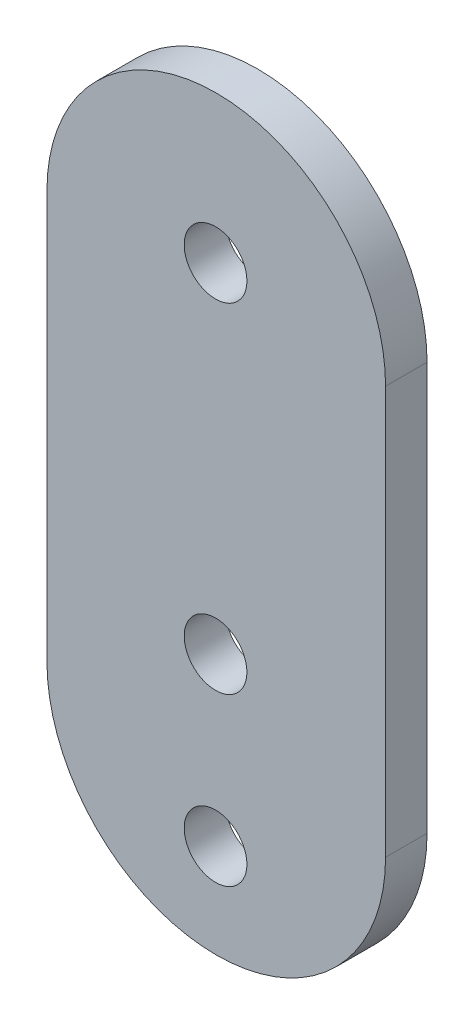
from build123d import *

# Parameters (mm, degrees)
BOSS_EXTRUDE1_DEPTH = 2.778125
SKETCH3_R           = 2.1
CUT_EXTRUDE1_DEPTH  = 10


with BuildPart() as part:
    # Sketch1 → Boss-Extrude1 (new body)
    with BuildSketch(Plane.XY):
        with BuildLine():
            Line((-29.866346965, 39.245435109), (-29.866346965, 11.924084761))
            ThreePointArc((-29.866346965, 11.924084761), (-18.527022139, 0.584759935), (-7.187697313, 11.924084761))
            Line((-7.187697313, 11.924084761), (-7.187697313, 39.245435109))
            ThreePointArc((-7.187697313, 39.245435109), (-18.527022139, 50.584759935), (-29.866346965, 39.245435109))
        make_face()
    extrude(amount=BOSS_EXTRUDE1_DEPTH)

    # Sketch3 → Cut-Extrude1 (cut)
    with BuildSketch(Plane.XY.offset(2.778125)):
        with Locations((-18.573973328, 6.87125142)):
            Circle(SKETCH3_R)
        with Locations((-18.573973328, 18.010449169)):
            Circle(SKETCH3_R)
        with Locations((-18.573973328, 40.706749197)):
            Circle(SKETCH3_R)
    extrude(amount=-CUT_EXTRUDE1_DEPTH, mode=Mode.SUBTRACT)


solid = part.part
